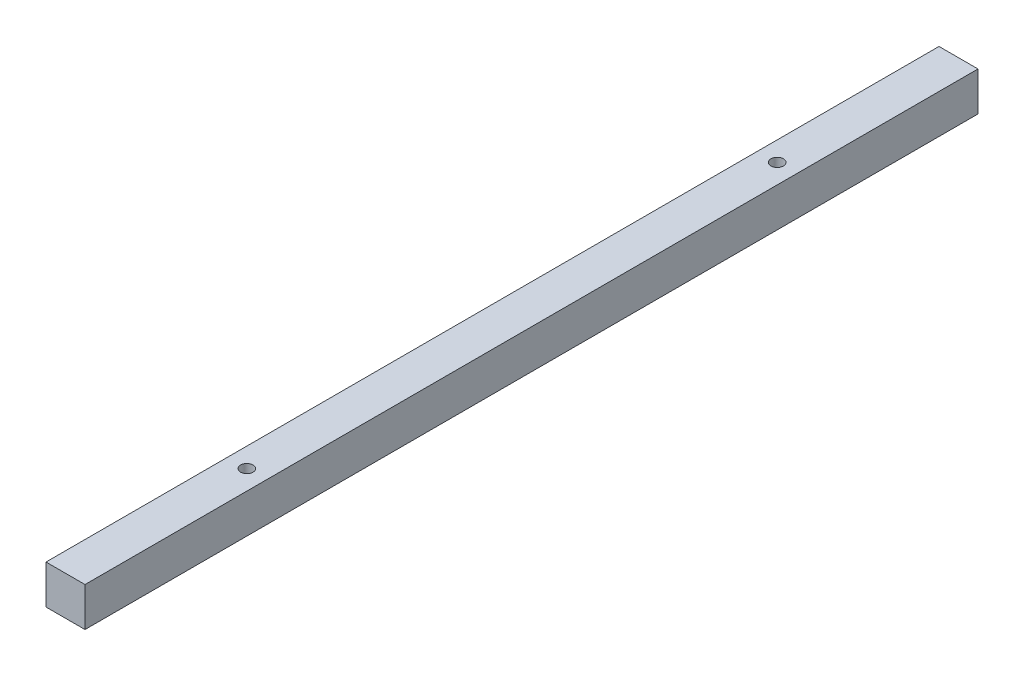
from build123d import *

# Parameters (mm, degrees)
BOSS_EXTRU_1_DEPTH      = 114.5
BOSS_EXTRU_1_DEPTH_BACK = 114.5
ESQUISSE1_W             = 10
ESQUISSE1_H             = 10
ESQUISSE2_R             = 1.6
ENL_V_MAT_EXTRU_1_DEPTH = 116.044556586


with BuildPart() as part:
    # Esquisse1 → Boss.-Extru.1 (new, two sides: drawn at the far end of the back side and taken through both)
    with BuildSketch(Plane.XY.offset(-BOSS_EXTRU_1_DEPTH_BACK)):
        Rectangle(ESQUISSE1_W, ESQUISSE1_H)
    extrude(amount=BOSS_EXTRU_1_DEPTH + BOSS_EXTRU_1_DEPTH_BACK)

    # Esquisse2 → Enlèv. mat.-Extru.1 (cut, through all)
    with BuildSketch(Plane(origin=(0, 5, 0), x_dir=(1, 0, 0), z_dir=(0, 1, 0))):
        with Locations(Location((0, 68, 0), (0, 0, 270))):
            Circle(ESQUISSE2_R)
        with Locations(Location((0, -68, 0), (0, 0, 270))):
            Circle(ESQUISSE2_R)
    extrude(amount=-ENL_V_MAT_EXTRU_1_DEPTH, mode=Mode.SUBTRACT)


solid = part.part
